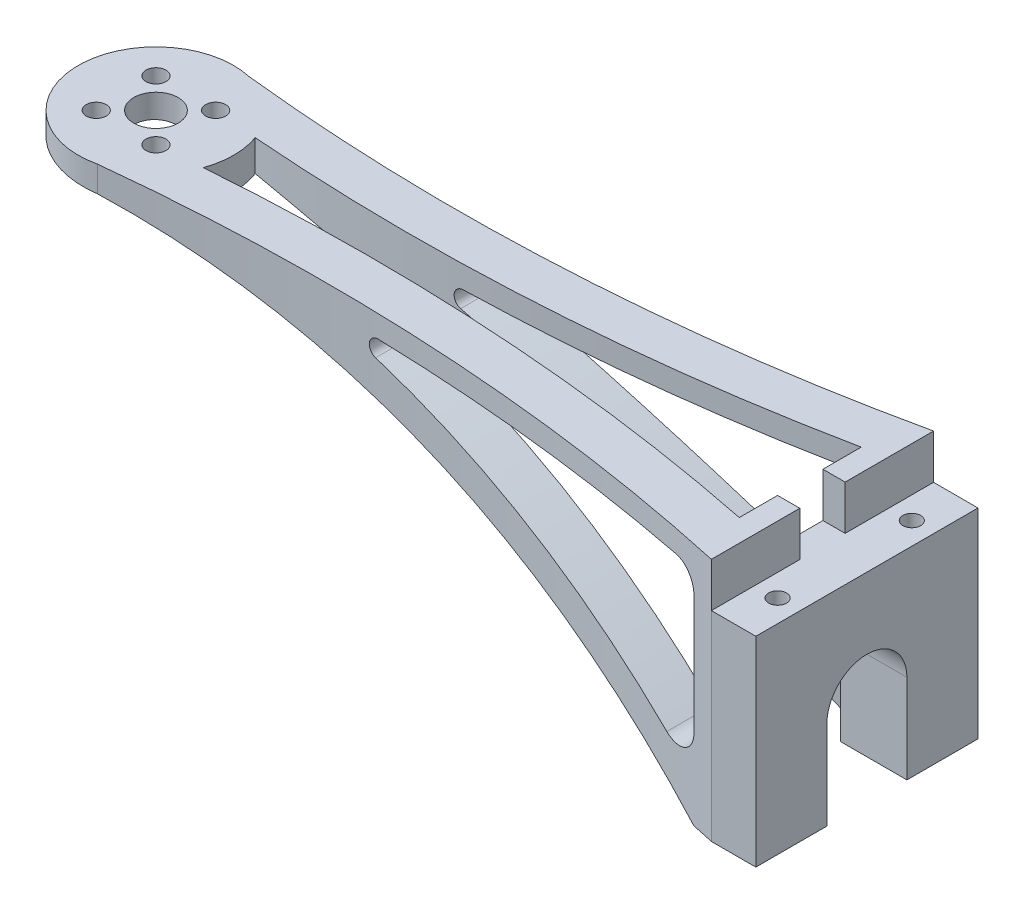
from build123d import *

# Parameters (mm, degrees)
BASE_DEPTH             = 5
SUPPORT_DEPTH          = 30
SUPPORT_DEPTH_BACK     = 30
ESQUISSE7_OUTSIDE_W    = 218.554
ESQUISSE7_OUTSIDE_H    = 101.054
AJUSTEMENT_DEPTH       = 187.832143915
TROU_CENTRE_DEPTH      = 188.500000137
ESQUISSE11_R           = 2.25
ESQUISSE11_R_2         = 5
TROU_MOTEUR_DEPTH      = 188.500000137
CONG_2_R               = 5
CONG_3_R               = 2
TROU_SUPPORT_DEPTH     = 10
ESQUISSE13_R           = 2
INSERT_HAUT_DEPTH      = 7
PONT_REACH             = 188.095
PONT_DIRECTION_2_DEPTH = 187.094734075
ESQUISSE14_R           = 2
INSERT_BAS_DEPTH       = 7


with BuildPart() as part:
    # Esquisse2 → Base (new body)
    with BuildSketch(Plane(origin=(0, 0, 0), x_dir=(1, 0, 0), z_dir=(0, 1, 0))):
        with BuildLine():
            ThreePointArc((-10, 25), (-82.734029234, 15.101895807), (-156.112273553, 17.062695657))
            ThreePointArc((-156.112273553, 17.062695657), (-177.5, 0), (-156.112273553, -17.062695657))
            ThreePointArc((-156.112273553, -17.062695657), (-82.734029234, -15.101895807), (-10, -25))
            Line((-10, -25), (0, -25))
            Line((0, -25), (0, 25))
            Line((0, 25), (-10, 25))
        make_face()
    extrude(amount=BASE_DEPTH)

    # Esquisse6 → Support (add, two sides: drawn at the far end of the back side and taken through both)
    with BuildSketch(Plane.XY.offset(-SUPPORT_DEPTH_BACK)):
        with BuildLine():
            Line((0, 0), (0, -50))
            Line((0, -50), (-15, -50))
            ThreePointArc((-15, -50), (-92.49080932, -12.782630291), (-177.5, 0))
            Line((-177.5, 0), (-111.226419291, 0))
            ThreePointArc((-111.226419291, 0), (-61.29219157, -16.216276522), (-15, -40.983749587))
            Line((-15, -40.983749587), (-15, 0))
            Line((-15, 0), (0, 0))
        make_face()
    extrude(amount=SUPPORT_DEPTH + SUPPORT_DEPTH_BACK)

    # Esquisse7 outside → Ajustement (cut, through all)
    with BuildSketch(Plane(origin=(0, 0, 0), x_dir=(1, 0, 0), z_dir=(0, 1, 0))):
        with Locations((-88.75, 0)):
            Rectangle(ESQUISSE7_OUTSIDE_W, ESQUISSE7_OUTSIDE_H)
        with BuildLine():
            Line((-10, -25), (0, -25))
            Line((0, -25), (0, 25))
            Line((0, 25), (-10, 25))
            ThreePointArc((-10, 25), (-82.734029234, 15.101895807), (-156.112273553, 17.062695657))
            ThreePointArc((-156.112273553, 17.062695657), (-177.5, 0), (-156.112273553, -17.062695657))
            ThreePointArc((-156.112273553, -17.062695657), (-82.734029234, -15.101895807), (-10, -25))
        make_face(mode=Mode.SUBTRACT)
    extrude(amount=-AJUSTEMENT_DEPTH, mode=Mode.SUBTRACT)

    # Esquisse9 → Trou_centre (cut, through all)
    with BuildSketch(Plane(origin=(0, 5, 0), x_dir=(1, 0, 0), z_dir=(0, 1, 0))):
        with BuildLine():
            Line((-15, -13.722068475), (-15, 13.722068475))
            ThreePointArc((-15, 13.722068475), (-78.978011617, 5.302380383), (-143.505381198, 5.846156906))
            ThreePointArc((-143.505381198, 5.846156906), (-142.5, 0), (-143.505381198, -5.846156906))
            ThreePointArc((-143.505381198, -5.846156906), (-78.978011617, -5.302380383), (-15, -13.722068475))
        make_face()
    extrude(amount=-TROU_CENTRE_DEPTH, mode=Mode.SUBTRACT)

    # Esquisse11 → Trou_moteur (cut, through all)
    with BuildSketch(Plane(origin=(0, 5, 0), x_dir=(1, 0, 0), z_dir=(0, 1, 0))):
        with Locations(Location((-153.282485579, 6.717514421, 0), (0, 0, 270))):
            Circle(ESQUISSE11_R)
        with Locations(Location((-153.282485579, -6.717514421, 0), (0, 0, 270))):
            Circle(ESQUISSE11_R)
        with Locations(Location((-166.717514421, -6.717514421, 0), (0, 0, 270))):
            Circle(ESQUISSE11_R)
        with Locations(Location((-166.717514421, 6.717514421, 0), (0, 0, 270))):
            Circle(ESQUISSE11_R)
        with Locations(Location((-160, 0, 0), (0, 0, 270))):
            Circle(ESQUISSE11_R_2)
    extrude(amount=-TROU_MOTEUR_DEPTH, mode=Mode.SUBTRACT)

    # Congé2
    cong_2_edges = [part.edges().sort_by_distance(p)[0] for p in [
        (-15, -40.983749587, 18.826594184),
        (-15, -40.983749587, -18.826594184),
        (-15, 0, -18.826594184),
        (-15, 0, 18.826594184),
    ]]
    fillet(cong_2_edges, radius=CONG_2_R)

    # Congé3
    cong_3_edges = [part.edges().sort_by_distance(p)[0] for p in [
        (-111.226419291, 0, -9.45038232),
        (-111.226419291, 0, 9.45038232),
    ]]
    fillet(cong_3_edges, radius=CONG_3_R)

    # Esquisse12 → Trou_support (cut)
    with BuildSketch(Plane(origin=(0, 5, 0), x_dir=(1, 0, 0), z_dir=(0, 1, 0))):
        Polygon((-15, -5.1), (-10, -5.1), (-10, -25), (0, -25), (0, 25), (-10, 25), (-10, 5.1), (-15, 5.1), align=None)
    extrude(amount=-TROU_SUPPORT_DEPTH, mode=Mode.SUBTRACT)

    # Esquisse13 → Insert_haut (cut)
    with BuildSketch(Plane(origin=(0, -5, 0), x_dir=(1, 0, 0), z_dir=(0, 1, 0))):
        with Locations(Location((-5, -15.1, 0), (0, 0, 270))):
            Circle(ESQUISSE13_R)
        with Locations(Location((-5, 15.1, 0), (0, 0, 270))):
            Circle(ESQUISSE13_R)
    extrude(amount=-INSERT_HAUT_DEPTH, mode=Mode.SUBTRACT)

    # Esquisse15 → Pont (cut, up to next)
    with BuildSketch(Plane(origin=(0, 0, 0), x_dir=(0, 0, -1), z_dir=(1, 0, 0)), mode=Mode.PRIVATE) as pont_sk1:
        with BuildLine():
            Line((-9, -50), (-9, -30))
            ThreePointArc((-9, -30), (0, -21), (9, -30))
            Line((9, -30), (9, -50))
            Line((9, -50), (-9, -50))
        make_face()
    pont_tool1 = extrude(pont_sk1.sketch, amount=-PONT_REACH, mode=Mode.PRIVATE) & part.part
    add(pont_tool1.solids().sort_by_distance((0, -36.391173, 0))[0], mode=Mode.SUBTRACT)

    # Esquisse15 → Pont direction 2 (cut)
    with BuildSketch(Plane(origin=(0, 0, 0), x_dir=(0, 0, -1), z_dir=(1, 0, 0))):
        with BuildLine():
            Line((-9, -50), (-9, -30))
            ThreePointArc((-9, -30), (0, -21), (9, -30))
            Line((9, -30), (9, -50))
            Line((9, -50), (-9, -50))
        make_face()
    extrude(amount=PONT_DIRECTION_2_DEPTH, mode=Mode.SUBTRACT)

    # Esquisse14 → Insert_bas (cut)
    with BuildSketch(Plane.XZ.offset(50)):
        with Locations(Location((-7.5, 17, 0), (0, 0, 270))):
            Circle(ESQUISSE14_R)
        with Locations(Location((-7.5, -17, 0), (0, 0, 270))):
            Circle(ESQUISSE14_R)
    extrude(amount=-INSERT_BAS_DEPTH, mode=Mode.SUBTRACT)


solid = part.part
